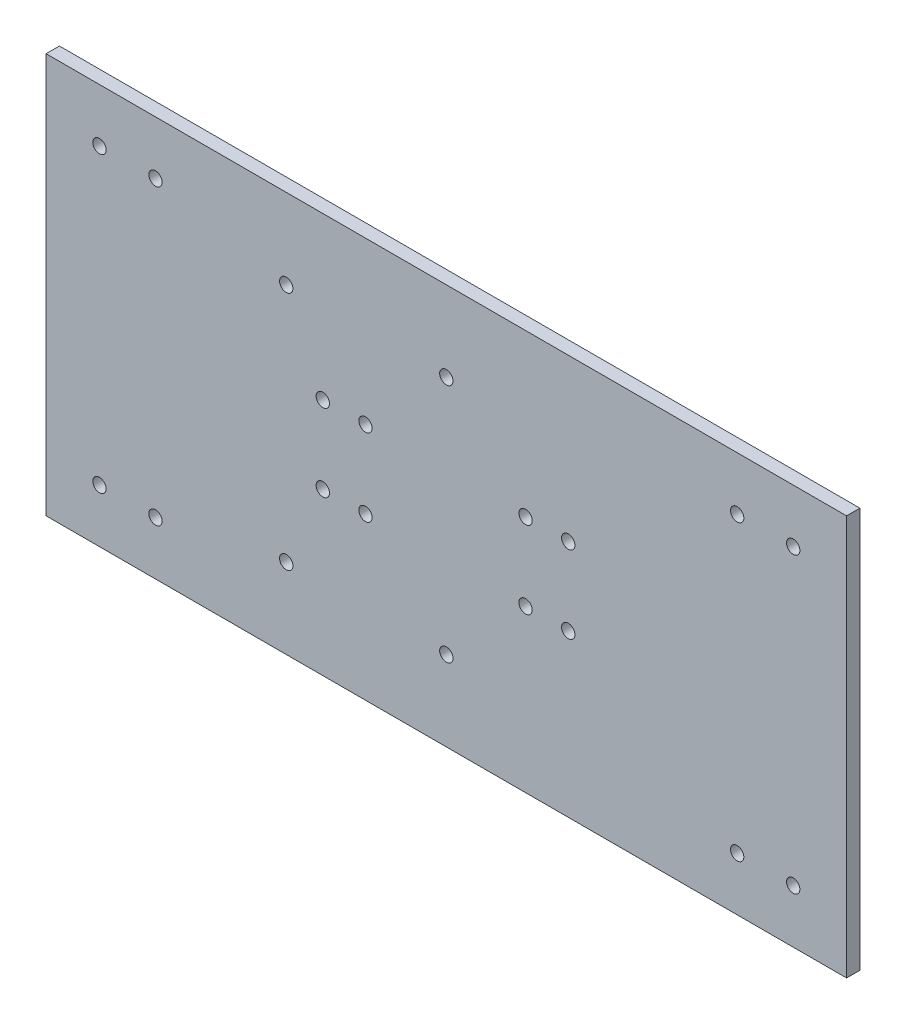
from build123d import *

# Parameters (mm, degrees)
ESQUISSE1_W        = 300
ESQUISSE1_H        = 150
ESQUISSE1_R        = 2.5
BOSS_EXTRU_1_DEPTH = 5


with BuildPart() as part:
    # Esquisse1 → Boss.-Extru.1 (new body)
    with BuildSketch(Plane.XY):
        with Locations((150, 75)):
            Rectangle(ESQUISSE1_W, ESQUISSE1_H)
        with Locations((150, 30)):
            Circle(ESQUISSE1_R, mode=Mode.SUBTRACT)
        with Locations((150, 120)):
            Circle(ESQUISSE1_R, mode=Mode.SUBTRACT)
        with Locations((103.7, 89.5)):
            Circle(ESQUISSE1_R, mode=Mode.SUBTRACT)
        with Locations((103.7, 60.5)):
            Circle(ESQUISSE1_R, mode=Mode.SUBTRACT)
        with Locations((119.7, 89.5)):
            Circle(ESQUISSE1_R, mode=Mode.SUBTRACT)
        with Locations((119.7, 60.5)):
            Circle(ESQUISSE1_R, mode=Mode.SUBTRACT)
        with Locations((90, 120)):
            Circle(ESQUISSE1_R, mode=Mode.SUBTRACT)
        with Locations((90, 30)):
            Circle(ESQUISSE1_R, mode=Mode.SUBTRACT)
        with Locations((179.7, 89.5)):
            Circle(ESQUISSE1_R, mode=Mode.SUBTRACT)
        with Locations((179.7, 60.5)):
            Circle(ESQUISSE1_R, mode=Mode.SUBTRACT)
        with Locations((195.7, 89.5)):
            Circle(ESQUISSE1_R, mode=Mode.SUBTRACT)
        with Locations((195.7, 60.5)):
            Circle(ESQUISSE1_R, mode=Mode.SUBTRACT)
        with Locations((20, 130)):
            Circle(ESQUISSE1_R, mode=Mode.SUBTRACT)
        with Locations((41, 130)):
            Circle(ESQUISSE1_R, mode=Mode.SUBTRACT)
        with Locations((259, 130)):
            Circle(ESQUISSE1_R, mode=Mode.SUBTRACT)
        with Locations((280, 130)):
            Circle(ESQUISSE1_R, mode=Mode.SUBTRACT)
        with Locations((259, 20)):
            Circle(ESQUISSE1_R, mode=Mode.SUBTRACT)
        with Locations((280, 20)):
            Circle(ESQUISSE1_R, mode=Mode.SUBTRACT)
        with Locations((20, 20)):
            Circle(ESQUISSE1_R, mode=Mode.SUBTRACT)
        with Locations((41, 20)):
            Circle(ESQUISSE1_R, mode=Mode.SUBTRACT)
    extrude(amount=BOSS_EXTRU_1_DEPTH)


solid = part.part
